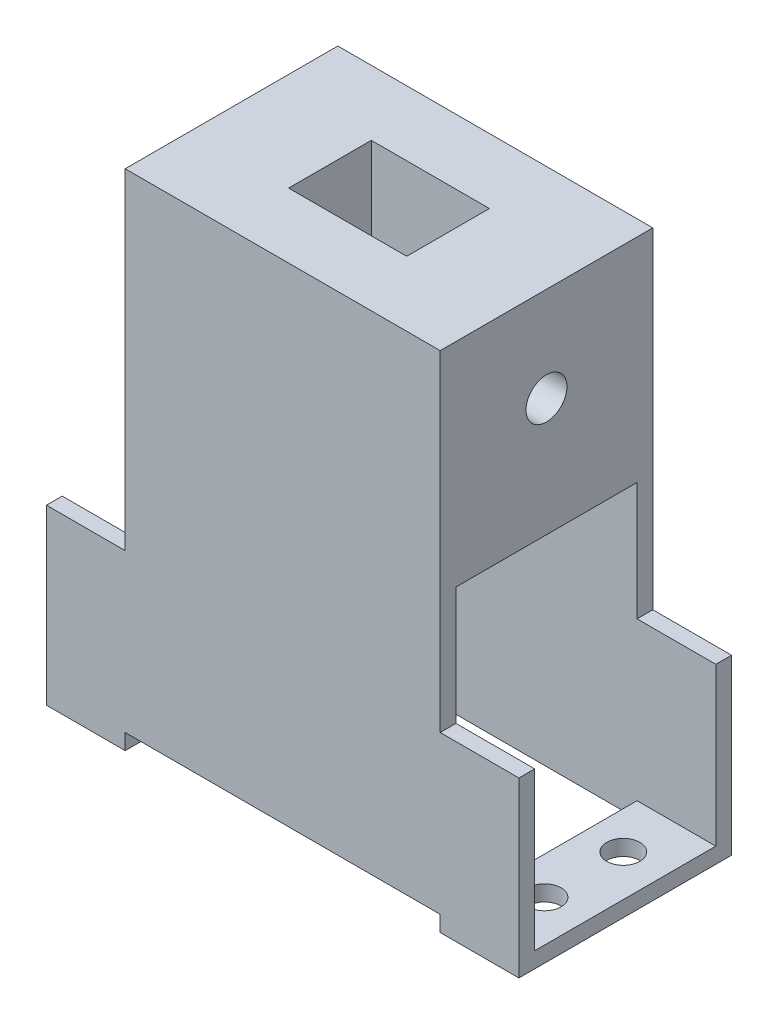
from build123d import *

# Parameters (mm, degrees)
SKETCH_1_W          = 10
SKETCH_1_H          = 20
SKETCH_1_W_2        = 40
SKETCH_1_H_2        = 35
EXTRUDE_1_DEPTH     = 2
SKETCH_3_W          = 10
SKETCH_3_H          = 25
EXTRUDE_2_DEPTH     = 2
EXTRUDE_3_DEPTH     = 2
CUT_EXTRUDE_1_REACH = 54.44
SKETCH_5_R          = 2.1
EXTRUDE_5_DEPTH     = 2
SKETCH_7_W          = 40
SKETCH_7_H          = 27
EXTRUDE_6_DEPTH     = 25
CUT_EXTRUDE_2_REACH = 73.451
SKETCH_8_R          = 2.6
SKETCH_9_W          = 15
SKETCH_9_H          = 10.5
CUT_EXTRUDE_3_DEPTH = 22.2


with BuildPart() as part:
    # 草图1 → 凸台-拉伸1 (new body)
    with BuildSketch(Plane.XY):
        with Locations((-25, -7.5)):
            Rectangle(SKETCH_1_W, SKETCH_1_H)
        Rectangle(SKETCH_1_W_2, SKETCH_1_H_2)
        with Locations((25, -7.5)):
            Rectangle(SKETCH_1_W, SKETCH_1_H)
    extrude(amount=EXTRUDE_1_DEPTH)

    # 草图3 → 凸台-拉伸2 (add)
    with BuildSketch(Plane.XZ.offset(17.5)):
        with Locations((-25, -10.5)):
            Rectangle(SKETCH_3_W, SKETCH_3_H)
        with Locations((25, -10.5)):
            Rectangle(SKETCH_3_W, SKETCH_3_H)
    extrude(amount=EXTRUDE_2_DEPTH)

    # 草图4 → 凸台-拉伸3 (add)
    with BuildSketch(Plane(origin=(0, 0, -23), x_dir=(-1, 0, 0), z_dir=(0, 0, -1))):
        Polygon((30, -19.5), (30, -17.5), (30, 2.5), (20, 2.5), (20, 17.5), (-20, 17.5), (-20, 2.5), (-30, 2.5), (-30, -17.5), (-30, -19.5), align=None)
    extrude(amount=EXTRUDE_3_DEPTH)

    # 草图5 → 切除-拉伸1 (cut, up to next)
    with BuildSketch(Plane(origin=(0, -17.5, 0), x_dir=(1, 0, 0), z_dir=(0, 1, 0)), mode=Mode.PRIVATE) as cut_extrude_1_sk1:
        with Locations(Location((24.75, 16.5, 0), (0, 0, 180))):
            Circle(SKETCH_5_R)
    cut_extrude_1_tool1 = extrude(cut_extrude_1_sk1.sketch, amount=-CUT_EXTRUDE_1_REACH, mode=Mode.PRIVATE) & part.part
    # 草图5 → 切除-拉伸1 (cut, up to next)
    with BuildSketch(Plane(origin=(0, -17.5, 0), x_dir=(1, 0, 0), z_dir=(0, 1, 0)), mode=Mode.PRIVATE) as cut_extrude_1_sk2:
        with Locations(Location((24.75, 6.5, 0), (0, 0, 180))):
            Circle(SKETCH_5_R)
    cut_extrude_1_tool2 = extrude(cut_extrude_1_sk2.sketch, amount=-CUT_EXTRUDE_1_REACH, mode=Mode.PRIVATE) & part.part
    # 草图5 → 切除-拉伸1 (cut, up to next)
    with BuildSketch(Plane(origin=(0, -17.5, 0), x_dir=(1, 0, 0), z_dir=(0, 1, 0)), mode=Mode.PRIVATE) as cut_extrude_1_sk3:
        with Locations(Location((-24.75, 16.5, 0), (0, 0, 180))):
            Circle(SKETCH_5_R)
    cut_extrude_1_tool3 = extrude(cut_extrude_1_sk3.sketch, amount=-CUT_EXTRUDE_1_REACH, mode=Mode.PRIVATE) & part.part
    # 草图5 → 切除-拉伸1 (cut, up to next)
    with BuildSketch(Plane(origin=(0, -17.5, 0), x_dir=(1, 0, 0), z_dir=(0, 1, 0)), mode=Mode.PRIVATE) as cut_extrude_1_sk4:
        with Locations(Location((-24.75, 6.5, 0), (0, 0, 180))):
            Circle(SKETCH_5_R)
    cut_extrude_1_tool4 = extrude(cut_extrude_1_sk4.sketch, amount=-CUT_EXTRUDE_1_REACH, mode=Mode.PRIVATE) & part.part
    add(cut_extrude_1_tool1.solids().sort_by_distance((24.75, -17.5, -16.5))[0], mode=Mode.SUBTRACT)
    add(cut_extrude_1_tool2.solids().sort_by_distance((24.75, -17.5, -6.5))[0], mode=Mode.SUBTRACT)
    add(cut_extrude_1_tool3.solids().sort_by_distance((-24.75, -17.5, -16.5))[0], mode=Mode.SUBTRACT)
    add(cut_extrude_1_tool4.solids().sort_by_distance((-24.75, -17.5, -6.5))[0], mode=Mode.SUBTRACT)

    # 草图6 → 凸台-拉伸5 (add)
    with BuildSketch(Plane(origin=(0, 17.5, 0), x_dir=(1, 0, 0), z_dir=(0, 1, 0))):
        Polygon((-20, 0), (-20, -2), (20, -2), (20, 0), (20, 23), (20, 25), (-20, 25), (-20, 23), align=None)
    extrude(amount=EXTRUDE_5_DEPTH)

    # 草图7 → 凸台-拉伸6 (add)
    with BuildSketch(Plane(origin=(0, 19.5, 0), x_dir=(1, 0, 0), z_dir=(0, 1, 0))):
        with Locations((0, 11.5)):
            Rectangle(SKETCH_7_W, SKETCH_7_H)
    extrude(amount=EXTRUDE_6_DEPTH)

    # 草图8 → 切除-拉伸2 (cut, up to next)
    with BuildSketch(Plane.ZY.offset(20), mode=Mode.PRIVATE) as cut_extrude_2_sk1:
        with Locations((-11.5, 32.5)):
            Circle(SKETCH_8_R)
    cut_extrude_2_tool1 = extrude(cut_extrude_2_sk1.sketch, amount=-CUT_EXTRUDE_2_REACH, mode=Mode.PRIVATE) & part.part
    add(cut_extrude_2_tool1.solids().sort_by_distance((-20, 32.5, -11.5))[0], mode=Mode.SUBTRACT)

    # 草图9 → 切除-拉伸3 (cut)
    with BuildSketch(Plane(origin=(0, 44.5, 0), x_dir=(1, 0, 0), z_dir=(0, 1, 0))):
        with Locations((0, 11.5)):
            Rectangle(SKETCH_9_W, SKETCH_9_H)
    extrude(amount=-CUT_EXTRUDE_3_DEPTH, mode=Mode.SUBTRACT)


solid = part.part
